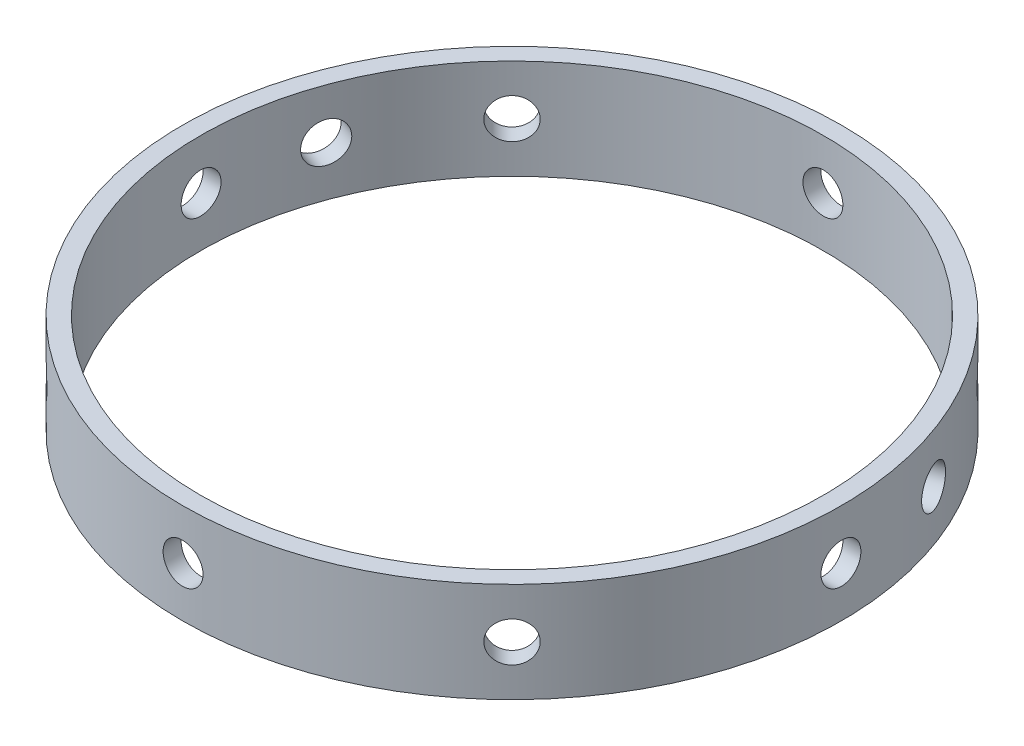
from build123d import *

# Parameters (mm, degrees)
SKETCH1_R                       = 41.91
SKETCH1_R_2                     = 39.624
BOSS_EXTRUDE2_DEPTH             = 12.7
SKETCH2_R                       = 2.54
CUT_EXTRUDE1_DEPTH              = 56.7
CIRPATTERN1_COUNT               = 8
CIRPATTERN2_COUNT               = 2
CIRPATTERN2_ANGLE               = 70
CIRPATTERN2_THE_OTHER_WAY_COUNT = 2
CIRPATTERN2_THE_OTHER_WAY_ANGLE = 70


with BuildPart() as part:
    # Sketch1 → Boss-Extrude2 (new body)
    with BuildSketch(Plane(origin=(0, 0, 0), x_dir=(1, 0, 0), z_dir=(0, 1, 0))):
        with Locations(Location((0, 0, 0), (0, 0, 270))):
            Circle(SKETCH1_R)
        with Locations(Location((0, 0, 0), (0, 0, 270))):
            Circle(SKETCH1_R_2, mode=Mode.SUBTRACT)
    extrude(amount=BOSS_EXTRUDE2_DEPTH)

    # Sketch2 → Cut-Extrude1 (cut)
    with BuildSketch(Plane.XY):
        with Locations(Location((0, 6.35, 0), (0, 0, 90))):
            Circle(SKETCH2_R)
    cut_extrude1 = extrude(amount=-CUT_EXTRUDE1_DEPTH, mode=Mode.SUBTRACT)

    # CirPattern1: Cut-Extrude1 ×8 about axis
    cirpattern1_axis = Axis((0, 12.7, 0), (0, 1, 0))
    for i in range(1, CIRPATTERN1_COUNT):
        add(cut_extrude1.rotate(cirpattern1_axis, i * 360 / CIRPATTERN1_COUNT), mode=Mode.SUBTRACT)

    # CirPattern2: Cut-Extrude1 ×2 about axis
    cirpattern2_axis = Axis((0, 12.7, 0), (0, 1, 0))
    for i in range(1, CIRPATTERN2_COUNT):
        add(cut_extrude1.rotate(cirpattern2_axis, i * CIRPATTERN2_ANGLE / (CIRPATTERN2_COUNT - 1)), mode=Mode.SUBTRACT)

    # CirPattern2 the other way: Cut-Extrude1 ×2 about axis
    cirpattern2_the_other_way_axis = Axis((0, 12.7, 0), (0, -1, 0))
    for i in range(1, CIRPATTERN2_THE_OTHER_WAY_COUNT):
        add(cut_extrude1.rotate(cirpattern2_the_other_way_axis, i * CIRPATTERN2_THE_OTHER_WAY_ANGLE / (CIRPATTERN2_THE_OTHER_WAY_COUNT - 1)), mode=Mode.SUBTRACT)


solid = part.part
